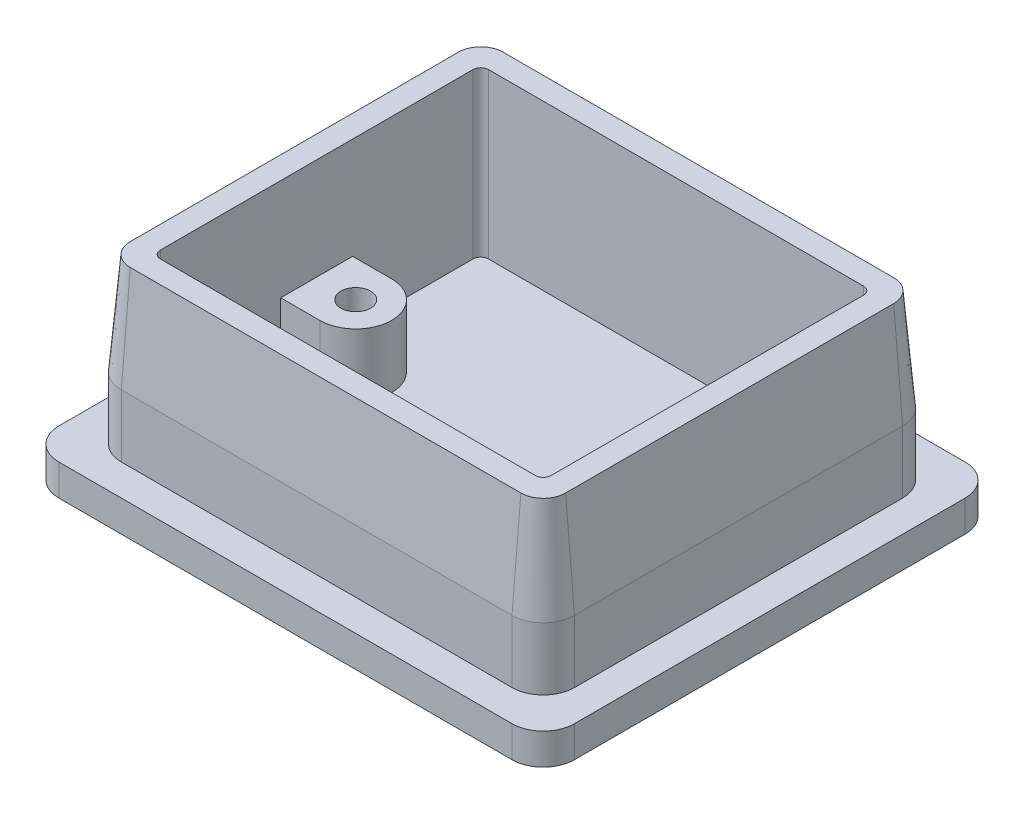
from build123d import *
from OCP.BRepFilletAPI import BRepFilletAPI_MakeChamfer

# Parameters (mm, degrees)
SKETCH1_W           = 33
SKETCH1_H           = 29
BOSS_EXTRUDE1_DEPTH = 2
SKETCH2_W           = 29
SKETCH2_H           = 25
SKETCH2_W_2         = 25
SKETCH2_H_2         = 21
BOSS_EXTRUDE2_DEPTH = 10.5
SKETCH3_W           = 10.5
SKETCH3_H           = 6
CUT_EXTRUDE1_DEPTH  = 2
SKETCH4_R           = 2.25
CUT_EXTRUDE2_DEPTH  = 2
SKETCH5_R           = 0.95
BOSS_EXTRUDE3_DEPTH = 4
FILLET1_R           = 2
FILLET2_R           = 0.5
CHAMFER1_SIZE       = 6.5
CHAMFER1_SIZE2      = 0.568676313


with BuildPart() as part:
    # Sketch1 → Boss-Extrude1 (new body)
    with BuildSketch(Plane(origin=(0, 0, 0), x_dir=(1, 0, 0), z_dir=(0, 1, 0))):
        Rectangle(SKETCH1_W, SKETCH1_H)
    extrude(amount=BOSS_EXTRUDE1_DEPTH)

    # Sketch2 → Boss-Extrude2 (add)
    with BuildSketch(Plane(origin=(0, 2, 0), x_dir=(1, 0, 0), z_dir=(0, 1, 0))):
        Rectangle(SKETCH2_W, SKETCH2_H)
        Rectangle(SKETCH2_W_2, SKETCH2_H_2, mode=Mode.SUBTRACT)
    extrude(amount=BOSS_EXTRUDE2_DEPTH)

    # Sketch3 → Cut-Extrude1 (cut)
    with BuildSketch(Plane(origin=(0, 2, 0), x_dir=(1, 0, 0), z_dir=(0, 1, 0))):
        with Locations((0, -6.5)):
            Rectangle(SKETCH3_W, SKETCH3_H)
    extrude(amount=-CUT_EXTRUDE1_DEPTH, mode=Mode.SUBTRACT)

    # Sketch4 → Cut-Extrude2 (cut)
    with BuildSketch(Plane(origin=(0, 2, 0), x_dir=(1, 0, 0), z_dir=(0, 1, 0))):
        with Locations(Location((6.5, 4.5, 0), (0, 0, 270))):
            Circle(SKETCH4_R)
    extrude(amount=-CUT_EXTRUDE2_DEPTH, mode=Mode.SUBTRACT)

    # Sketch5 → Boss-Extrude3 (add)
    with BuildSketch(Plane(origin=(0, 2, 0), x_dir=(1, 0, 0), z_dir=(0, 1, 0))):
        with BuildLine():
            Line((-10, 2.3), (-12.5, 2.3))
            Line((-12.5, 2.3), (-12.5, -2.3))
            Line((-12.5, -2.3), (-10, -2.3))
            ThreePointArc((-10, -2.3), (-7.7, 0), (-10, 2.3))
        make_face()
        with Locations(Location((-10, 0, 0), (0, 0, 270))):
            Circle(SKETCH5_R, mode=Mode.SUBTRACT)
    boss_extrude3 = extrude(amount=BOSS_EXTRUDE3_DEPTH)

    # Mirror1: Boss-Extrude3 across plane
    add(boss_extrude3.mirror(Plane(origin=(0, 0, 0), x_dir=(0, 0, 1), z_dir=(1, 0, 0))))

    # Fillet1
    fillet1_edges = [part.edges().sort_by_distance(p)[0] for p in [
        (14.5, 7.25, 12.5),
        (14.5, 7.25, -12.5),
        (-14.5, 7.25, -12.5),
        (-14.5, 7.25, 12.5),
        (16.5, 1, 14.5),
        (-16.5, 1, 14.5),
        (-16.5, 1, -14.5),
        (16.5, 1, -14.5),
    ]]
    fillet(fillet1_edges, radius=FILLET1_R)

    # Fillet2
    fillet2_edges = [part.edges().sort_by_distance(p)[0] for p in [
        (12.5, 7.25, -10.5),
        (-12.5, 7.25, -10.5),
        (-12.5, 7.25, 10.5),
        (12.5, 7.25, 10.5),
        (-5.25, 1, 3.5),
        (-5.25, 1, 9.5),
        (5.25, 1, 9.5),
        (5.25, 1, 3.5),
    ]]
    fillet(fillet2_edges, radius=FILLET2_R)

    # Chamfer1: one chamfer whose edges measure the first distance from different faces: ONE call of the kernel's chamfer builder (chamfer() names one face for all edges)
    chamfer1_edges_1 = [part.edges().sort_by_distance(p)[0] for p in [
        (-14.5, 12.5, 0),
    ]]
    chamfer1_side_1 = [part.faces().sort_by_distance(p)[0] for p in [
        (-14.5, 7.25, 0),
    ]]
    chamfer1_edges_2 = [part.edges().sort_by_distance(p)[0] for p in [
        (0, 12.5, -12.5),
    ]]
    chamfer1_side_2 = [part.faces().sort_by_distance(p)[0] for p in [
        (0, 7.25, -12.5),
    ]]
    chamfer1_edges_3 = [part.edges().sort_by_distance(p)[0] for p in [
        (14.5, 12.5, 0),
    ]]
    chamfer1_side_3 = [part.faces().sort_by_distance(p)[0] for p in [
        (14.5, 7.25, 0),
    ]]
    chamfer1_edges_4 = [part.edges().sort_by_distance(p)[0] for p in [
        (0, 12.5, 12.5),
    ]]
    chamfer1_side_4 = [part.faces().sort_by_distance(p)[0] for p in [
        (0, 7.25, 12.5),
    ]]
    chamfer1_edges_5 = [part.edges().sort_by_distance(p)[0] for p in [
        (13.914213562, 12.5, -11.914213562),
    ]]
    chamfer1_side_5 = [part.faces().sort_by_distance(p)[0] for p in [
        (13.914213562, 7.25, -11.914213562),
    ]]
    chamfer1_edges_6 = [part.edges().sort_by_distance(p)[0] for p in [
        (13.914213562, 12.5, 11.914213562),
    ]]
    chamfer1_side_6 = [part.faces().sort_by_distance(p)[0] for p in [
        (13.914213562, 7.25, 11.914213562),
    ]]
    chamfer1_edges_7 = [part.edges().sort_by_distance(p)[0] for p in [
        (-13.914213562, 12.5, 11.914213562),
    ]]
    chamfer1_side_7 = [part.faces().sort_by_distance(p)[0] for p in [
        (-13.914213562, 7.25, 11.914213562),
    ]]
    chamfer1_edges_8 = [part.edges().sort_by_distance(p)[0] for p in [
        (-13.914213562, 12.5, -11.914213562),
    ]]
    chamfer1_side_8 = [part.faces().sort_by_distance(p)[0] for p in [
        (-13.914213562, 7.25, -11.914213562),
    ]]
    chamfer1 = BRepFilletAPI_MakeChamfer(part.part.solid().wrapped)
    for e in chamfer1_edges_1:
        chamfer1.Add(CHAMFER1_SIZE, CHAMFER1_SIZE2, e.wrapped, chamfer1_side_1[0].wrapped)  # the first distance lies on this face
    for e in chamfer1_edges_2:
        chamfer1.Add(CHAMFER1_SIZE, CHAMFER1_SIZE2, e.wrapped, chamfer1_side_2[0].wrapped)  # the first distance lies on this face
    for e in chamfer1_edges_3:
        chamfer1.Add(CHAMFER1_SIZE, CHAMFER1_SIZE2, e.wrapped, chamfer1_side_3[0].wrapped)  # the first distance lies on this face
    for e in chamfer1_edges_4:
        chamfer1.Add(CHAMFER1_SIZE, CHAMFER1_SIZE2, e.wrapped, chamfer1_side_4[0].wrapped)  # the first distance lies on this face
    for e in chamfer1_edges_5:
        chamfer1.Add(CHAMFER1_SIZE, CHAMFER1_SIZE2, e.wrapped, chamfer1_side_5[0].wrapped)  # the first distance lies on this face
    for e in chamfer1_edges_6:
        chamfer1.Add(CHAMFER1_SIZE, CHAMFER1_SIZE2, e.wrapped, chamfer1_side_6[0].wrapped)  # the first distance lies on this face
    for e in chamfer1_edges_7:
        chamfer1.Add(CHAMFER1_SIZE, CHAMFER1_SIZE2, e.wrapped, chamfer1_side_7[0].wrapped)  # the first distance lies on this face
    for e in chamfer1_edges_8:
        chamfer1.Add(CHAMFER1_SIZE, CHAMFER1_SIZE2, e.wrapped, chamfer1_side_8[0].wrapped)  # the first distance lies on this face
    add(Compound.cast(chamfer1.Shape()), mode=Mode.REPLACE)


solid = part.part
